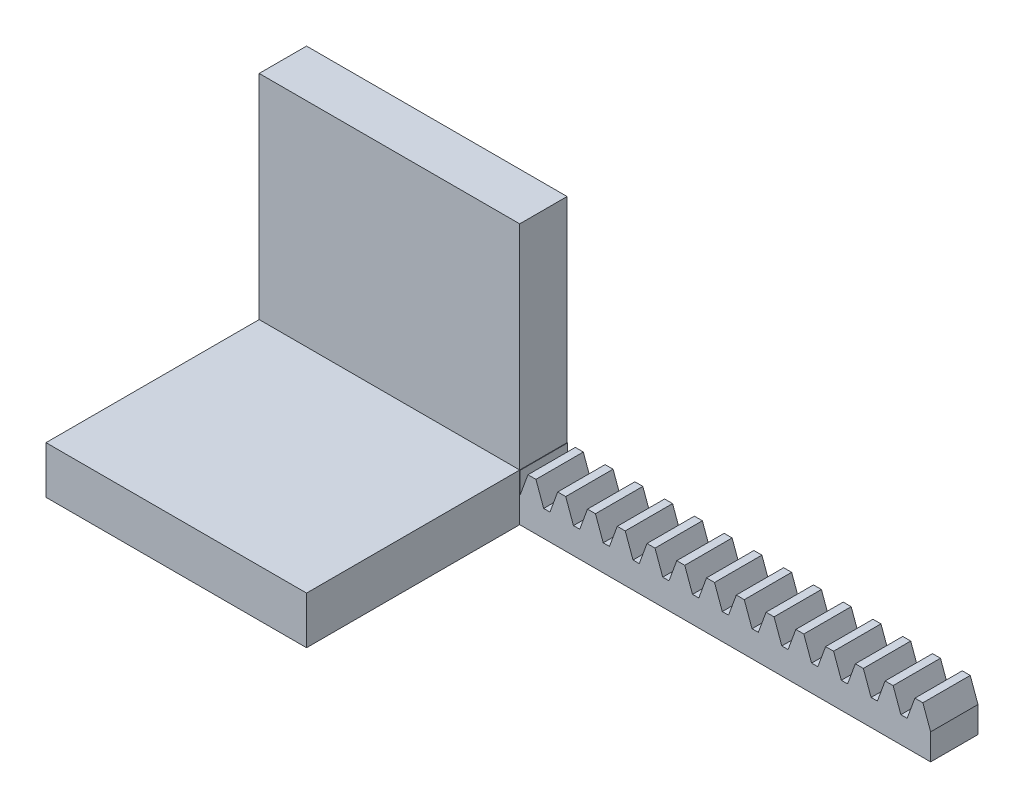
from build123d import *

# Parameters (mm, degrees)
SKETCH_2_W             = 86.642852818
SKETCH_2_H             = 10
EXTRUDE_1_DEPTH        = 5.5
EXTRUDE_2_DEPTH        = 5
PATTERN_LINEAR_1_COUNT = 14
PATTERN_LINEAR_1_PITCH = 6.283185307
SKETCH_6_W             = 10
SKETCH_6_H             = 10
EXTRUDE_3_DEPTH        = 0.1
SKETCH_7_W             = 45
SKETCH_7_H             = 10
SKETCH_7_W_2           = 10
SKETCH_7_H_2           = 45
EXTRUDE_4_DEPTH        = 55


with BuildPart() as part:
    # 草图2 → 凸台-拉伸1 (new body)
    with BuildSketch(Plane(origin=(0, 0, 0), x_dir=(1, 0, 0), z_dir=(0, 1, 0))):
        Rectangle(SKETCH_2_W, SKETCH_2_H)
    extrude(amount=-EXTRUDE_1_DEPTH)

    # 草图3 → 凸台-拉伸2 (add, symmetric)
    with BuildSketch(Plane.XY):
        Polygon((-43.321426409, 0), (-41.683560355, 4.5), (-39.997848638, 4.5), (-38.359982584, 0), align=None)
    extrude_2 = extrude(amount=EXTRUDE_2_DEPTH, both=True)

    # 阵列(线性)1: 凸台-拉伸2 ×14
    with Locations(*[(i * PATTERN_LINEAR_1_PITCH, 0, 0) for i in range(1, PATTERN_LINEAR_1_COUNT)]):
        add(extrude_2)

    # 草图6 → 凸台-拉伸3 (add)
    with BuildSketch(Plane.ZY.offset(43.321426409)):
        with Locations((0, -0.5)):
            Rectangle(SKETCH_6_W, SKETCH_6_H)
    extrude(amount=EXTRUDE_3_DEPTH)

    # 草图7 → 凸台-拉伸4 (add)
    with BuildSketch(Plane.ZY.offset(43.421426409)):
        with Locations((27.5, -0.5)):
            Rectangle(SKETCH_7_W, SKETCH_7_H)
        with Locations((0, -0.5)):
            Rectangle(SKETCH_7_W_2, SKETCH_7_H)
        with Locations((0, 27)):
            Rectangle(SKETCH_7_W_2, SKETCH_7_H_2)
    extrude(amount=EXTRUDE_4_DEPTH)


solid = part.part
